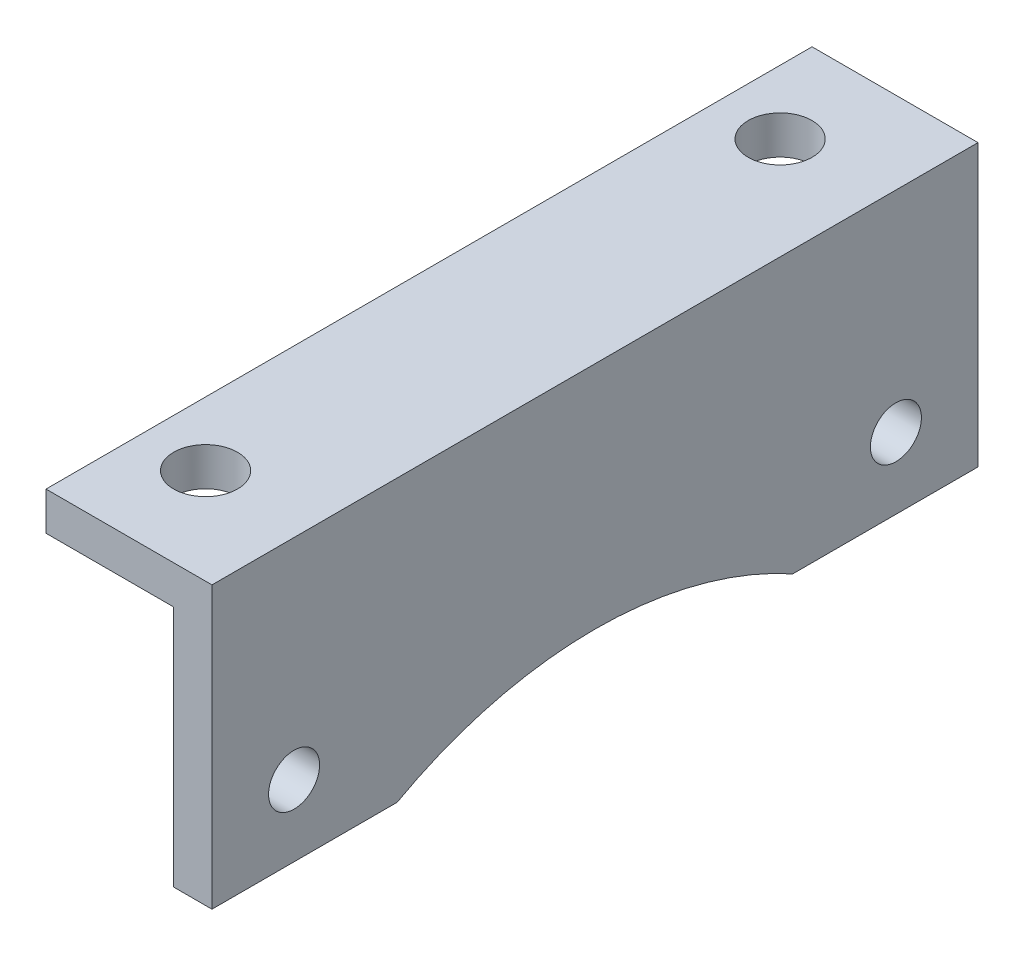
from build123d import *

# Parameters (mm, degrees)
CROQUIS1_W              = 10
CROQUIS1_H              = 60
CROQUIS1_R              = 2.5
SALIENTE_EXTRUIR1_DEPTH = 1.5
CROQUIS2_W              = 3
CROQUIS2_H              = 60
SALIENTE_EXTRUIR2_DEPTH = 12
CROQUIS4_R              = 32
CORTAR_EXTRUIR2_DEPTH   = 34.320414163
SKETCH1_W               = 13
SKETCH1_H               = 10
BOSS_EXTRUDE1_DEPTH     = 60
SKETCH2_R               = 2.5
CUT_EXTRUDE1_DEPTH      = 34.109666262
SKETCH3_W               = 10
SKETCH3_H               = 8.5
CUT_EXTRUDE2_DEPTH      = 62.613716005
SKETCH4_R               = 2
CUT_EXTRUDE3_DEPTH      = 34.648922717


with BuildPart() as part:
    # Croquis1 → Saliente-Extruir1 (new body)
    with BuildSketch(Plane(origin=(0, 0, 0), x_dir=(1, 0, 0), z_dir=(0, 1, 0))):
        Rectangle(CROQUIS1_W, CROQUIS1_H)
        with Locations(Location((0, 22.5, 0), (0, 0, 270))):
            Circle(CROQUIS1_R, mode=Mode.SUBTRACT)
        with Locations(Location((0, -22.5, 0), (0, 0, 270))):
            Circle(CROQUIS1_R, mode=Mode.SUBTRACT)
    extrude(amount=SALIENTE_EXTRUIR1_DEPTH)

    # Croquis2 → Saliente-Extruir2 (add)
    with BuildSketch(Plane(origin=(0, 1.5, 0), x_dir=(1, 0, 0), z_dir=(0, 1, 0))):
        with Locations((6.5, 0)):
            Rectangle(CROQUIS2_W, CROQUIS2_H)
    extrude(amount=-SALIENTE_EXTRUIR2_DEPTH)

    # Croquis4 → Cortar-Extruir2 (cut, through all)
    with BuildSketch(Plane.ZY.offset(-5)):
        with Locations((0, -38.5)):
            Circle(CROQUIS4_R)
    extrude(amount=-CORTAR_EXTRUIR2_DEPTH, mode=Mode.SUBTRACT)

    # Sketch1 → Boss-Extrude1 (add)
    with BuildSketch(Plane(origin=(0, 0, -30), x_dir=(-1, 0, 0), z_dir=(0, 0, -1))):
        with Locations((-1.5, 6.5)):
            Rectangle(SKETCH1_W, SKETCH1_H)
    extrude(amount=-BOSS_EXTRUDE1_DEPTH)

    # Sketch2 → Cut-Extrude1 (cut, through all)
    with BuildSketch(Plane.XZ):
        with Locations(Location((0, -22.5, 0), (0, 0, 270))):
            Circle(SKETCH2_R)
        with Locations(Location((0, 22.5, 0), (0, 0, 270))):
            Circle(SKETCH2_R)
    extrude(amount=-CUT_EXTRUDE1_DEPTH, mode=Mode.SUBTRACT)

    # Sketch3 → Cut-Extrude2 (cut, through all)
    with BuildSketch(Plane(origin=(0, 0, -30), x_dir=(-1, 0, 0), z_dir=(0, 0, -1))):
        with Locations((0, 4.25)):
            Rectangle(SKETCH3_W, SKETCH3_H)
    extrude(amount=-CUT_EXTRUDE2_DEPTH, mode=Mode.SUBTRACT)

    # Sketch4 → Cut-Extrude3 (cut, through all)
    with BuildSketch(Plane.ZY.offset(-5)):
        with Locations((-23.57, -4.93)):
            Circle(SKETCH4_R)
    cut_extrude3 = extrude(amount=-CUT_EXTRUDE3_DEPTH, mode=Mode.SUBTRACT)

    # Mirror1: Cut-Extrude3 across plane
    add(cut_extrude3.mirror(Plane.XY), mode=Mode.SUBTRACT)


solid = part.part
